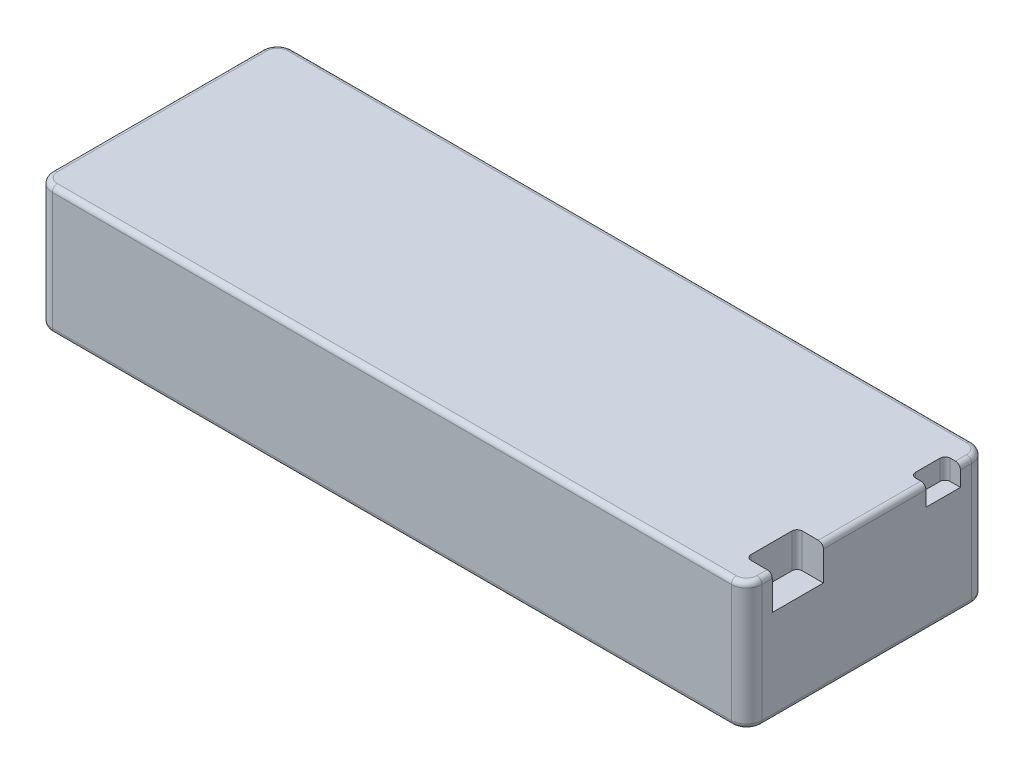
from build123d import *

# Parameters (mm, degrees)
SKETCH1_W           = 138.8
SKETCH1_H           = 47
BOSS_EXTRUDE1_DEPTH = 25
SKETCH2_W           = 10
SKETCH2_H           = 6.75
CUT_EXTRUDE1_DEPTH  = 5.15
SKETCH3_W           = 6.75
SKETCH3_H           = 3.95
CUT_EXTRUDE2_DEPTH  = 3
FILLET1_R           = 3
FILLET2_R           = 1
FILLET3_R           = 1


with BuildPart() as part:
    # Sketch1 → Boss-Extrude1 (new body)
    with BuildSketch(Plane(origin=(0, 0, 0), x_dir=(1, 0, 0), z_dir=(0, 1, 0))):
        Rectangle(SKETCH1_W, SKETCH1_H)
    extrude(amount=BOSS_EXTRUDE1_DEPTH)

    # Sketch2 → Cut-Extrude1 (cut)
    with BuildSketch(Plane(origin=(69.4, 0, 0), x_dir=(0, 0, -1), z_dir=(1, 0, 0))):
        with Locations((-13.5, 21.625)):
            Rectangle(SKETCH2_W, SKETCH2_H)
    extrude(amount=-CUT_EXTRUDE1_DEPTH, mode=Mode.SUBTRACT)

    # Sketch3 → Cut-Extrude2 (cut)
    with BuildSketch(Plane(origin=(69.4, 0, 0), x_dir=(0, 0, -1), z_dir=(1, 0, 0))):
        with Locations((14.925, 23.025)):
            Rectangle(SKETCH3_W, SKETCH3_H)
    extrude(amount=-CUT_EXTRUDE2_DEPTH, mode=Mode.SUBTRACT)

    # Fillet1
    fillet1_edges = [part.edges().sort_by_distance(p)[0] for p in [
        (-69.4, 12.5, 23.5),
        (-69.4, 12.5, -23.5),
        (69.4, 12.5, -23.5),
        (69.4, 12.5, 23.5),
    ]]
    fillet(fillet1_edges, radius=FILLET1_R)

    # Fillet2
    fillet2_edges = [part.edges().sort_by_distance(p)[0] for p in [
        (69.4, 25, -1.525),
        (69.4, 25, -19.4),
        (-69.4, 0, 0),
        (-69.4, 25, 0),
        (0, 0, 23.5),
        (0, 0, -23.5),
        (69.4, 0, 0),
        (-68.521320344, 0, 22.621320344),
        (68.521320344, 0, 22.621320344),
        (68.521320344, 0, -22.621320344),
        (-68.521320344, 0, -22.621320344),
        (0, 25, -23.5),
        (0, 25, 23.5),
        (69.4, 25, 19.5),
        (-68.521320344, 25, 22.621320344),
        (68.521320344, 25, 22.621320344),
        (68.521320344, 25, -22.621320344),
        (-68.521320344, 25, -22.621320344),
    ]]
    fillet(fillet2_edges, radius=FILLET2_R)

    # Fillet3
    fillet3_edges = [part.edges().sort_by_distance(p)[0] for p in [
        (64.25, 21.625, 18.5),
        (64.25, 21.625, 8.5),
        (66.4, 23.025, -11.55),
        (66.4, 23.025, -18.3),
    ]]
    fillet(fillet3_edges, radius=FILLET3_R)


solid = part.part
